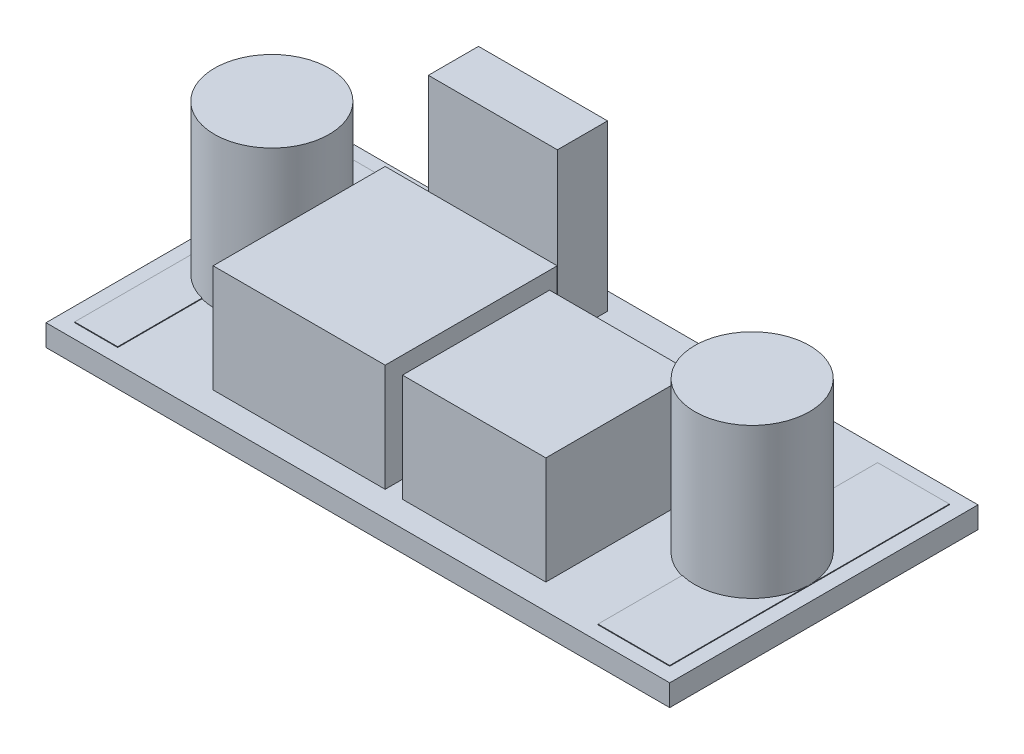
from build123d import *

# Parameters (mm, degrees)
SKETCH_1_W        = 43.5
SKETCH_1_H        = 21.5
EXTRUDE_1_DEPTH   = 1.5
SKETCH_6_W        = 5
SKETCH_6_H        = 19.5
SKETCH_6_W_2      = 3
EXTRUDE_4_DEPTH   = 1.55
SKETCH_4_W        = 12
SKETCH_4_H        = 12
SKETCH_4_W_2      = 10
SKETCH_4_H_2      = 10.262080876
EXTRUDE_3_DEPTH   = 9
SKETCH_4_2_W      = 9
SKETCH_4_2_H      = 3.495381259
EXTRUDE_5_DEPTH   = 13
SKETCH_4_3_R      = 4
EXTRUDE_6_DEPTH   = 12
EXTRUDE_6_2_DEPTH = 12


with BuildPart() as part:
    # Эскиз1 → Бобышка-Вытянуть1 (new body)
    with BuildSketch(Plane(origin=(0, 0, 0), x_dir=(1, 0, 0), z_dir=(0, 1, 0))):
        with Locations((-21.75, 0)):
            Rectangle(SKETCH_1_W, SKETCH_1_H)
    extrude(amount=EXTRUDE_1_DEPTH)

    # Эскиз6 → Бобышка-Вытянуть4 (add)
    with BuildSketch(Plane(origin=(0, 0, 0), x_dir=(1, 0, 0), z_dir=(0, 1, 0))):
        with Locations((-3.5, 0)):
            Rectangle(SKETCH_6_W, SKETCH_6_H)
        with Locations((-41, 0)):
            Rectangle(SKETCH_6_W_2, SKETCH_6_H)
    extrude(amount=EXTRUDE_4_DEPTH)

    # Эскиз4 → Бобышка-Вытянуть3 (add)
    with BuildSketch(Plane(origin=(0, 0, 0), x_dir=(1, 0, 0), z_dir=(0, 1, 0))):
        with Locations((-27.610333503, -2.984922339)):
            Rectangle(SKETCH_4_W, SKETCH_4_H)
        with Locations((-15.405622593, -3.853881901)):
            Rectangle(SKETCH_4_W_2, SKETCH_4_H_2)
    extrude(amount=EXTRUDE_3_DEPTH)


with BuildPart() as body_2:
    # Эскиз4<2> → Бобышка-Вытянуть5 (new body)
    with BuildSketch(Plane(origin=(0, 0, 0), x_dir=(1, 0, 0), z_dir=(0, 1, 0))):
        with Locations((-29.110333503, 7.774982673)):
            Rectangle(SKETCH_4_2_W, SKETCH_4_2_H)
    extrude(amount=EXTRUDE_5_DEPTH)


with BuildPart() as body_3:
    # Эскиз4<3> → Бобышка-Вытянуть6 (new body)
    with BuildSketch(Plane(origin=(0, 0, 0), x_dir=(1, 0, 0), z_dir=(0, 1, 0))):
        with Locations(Location((-38.5, 0, 0), (0, 0, 270))):
            Circle(SKETCH_4_3_R)
    extrude(amount=EXTRUDE_6_DEPTH)


with BuildPart() as body_4:
    # Эскиз4<3> → Extrude 6 2 (new body)
    with BuildSketch(Plane(origin=(0, 0, 0), x_dir=(1, 0, 0), z_dir=(0, 1, 0))):
        with Locations(Location((-5, 0, 0), (0, 0, 270))):
            Circle(SKETCH_4_3_R)
    extrude(amount=EXTRUDE_6_2_DEPTH)


solid = Compound([part.part, body_2.part, body_3.part, body_4.part])
